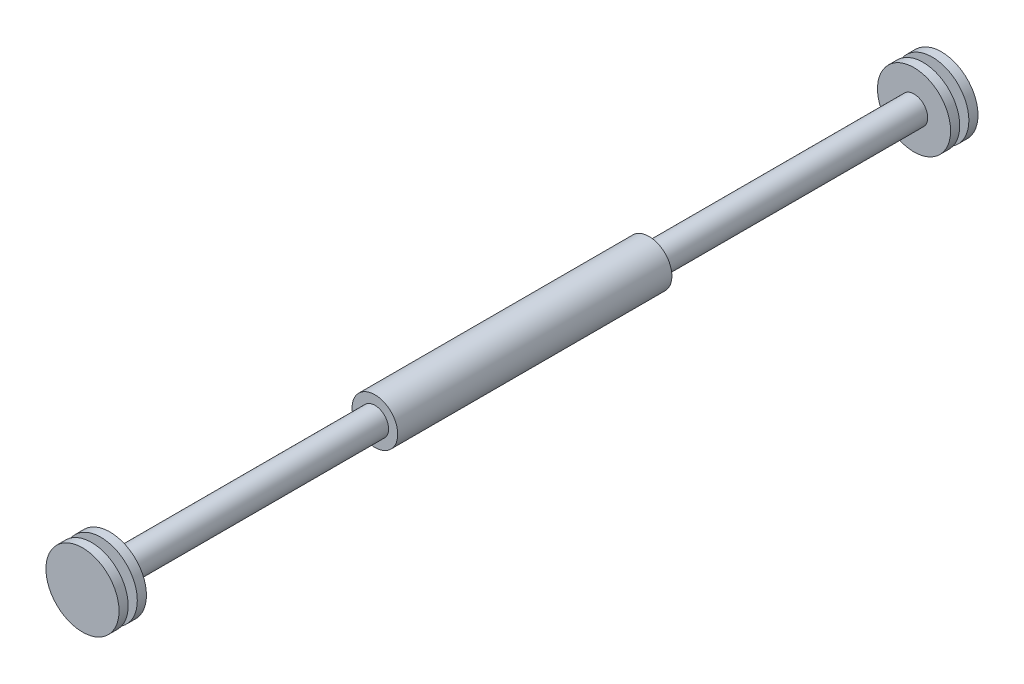
from build123d import *

# Parameters (mm, degrees)
SKETCH_1_R       = 3
EXTRUDE_1_DEPTH  = 180
SKETCH_2_R       = 8
EXTRUDE_2_DEPTH  = 2
EXTRUDE_START    = -178
SKETCH_2_2_R     = 8
EXTRUDE_3_DEPTH  = 2
EXTRUDE_START_2  = -2
SKETCH_1_2_R     = 3
EXTRUDE_4_DEPTH  = 2
EXTRUDE_START_3  = 180
SKETCH_1_3_R     = 3
EXTRUDE_5_DEPTH  = 2
EXTRUDE_START_4  = 4
SKETCH_2_3_R     = 8
EXTRUDE_6_DEPTH  = 2
EXTRUDE_START_5  = -182
SKETCH_2_4_R     = 8
EXTRUDE_7_DEPTH  = 2
EXTRUDE_START_6  = -64
SKETCH_3_R       = 5
EXTRUDE_10_DEPTH = 60


with BuildPart() as part:
    # 草图1 → 凸台-拉伸1 (new body)
    with BuildSketch(Plane.XY):
        with Locations(Location((0, 0, 0), (0, 0, 180))):
            Circle(SKETCH_1_R)
    extrude(amount=EXTRUDE_1_DEPTH)

    # 草图2 → 凸台-拉伸2 (add)
    with BuildSketch(Plane.XY.offset(180)):
        Circle(SKETCH_2_R)
    extrude(amount=-EXTRUDE_2_DEPTH)

    # 草图2<2> → 凸台-拉伸3 (add)
    with BuildSketch(Plane.XY.offset(180).offset(EXTRUDE_START)):
        Circle(SKETCH_2_2_R)
    extrude(amount=-EXTRUDE_3_DEPTH)

    # 草图1<2> → 凸台-拉伸4 (add)
    with BuildSketch(Plane.XY.offset(EXTRUDE_START_2)):
        with Locations(Location((0, 0, 0), (0, 0, 180))):
            Circle(SKETCH_1_2_R)
    extrude(amount=EXTRUDE_4_DEPTH)

    # 草图1<3> → 凸台-拉伸5 (add)
    with BuildSketch(Plane.XY.offset(EXTRUDE_START_3)):
        with Locations(Location((0, 0, 0), (0, 0, 180))):
            Circle(SKETCH_1_3_R)
    extrude(amount=EXTRUDE_5_DEPTH)

    # 草图2<3> → 凸台-拉伸6 (add)
    with BuildSketch(Plane.XY.offset(180).offset(EXTRUDE_START_4)):
        Circle(SKETCH_2_3_R)
    extrude(amount=-EXTRUDE_6_DEPTH)

    # 草图2<4> → 凸台-拉伸7 (add)
    with BuildSketch(Plane.XY.offset(180).offset(EXTRUDE_START_5)):
        Circle(SKETCH_2_4_R)
    extrude(amount=-EXTRUDE_7_DEPTH)

    # 草图3 → 凸台-拉伸10 (add)
    with BuildSketch(Plane.XY.offset(184).offset(EXTRUDE_START_6)):
        Circle(SKETCH_3_R)
    extrude(amount=-EXTRUDE_10_DEPTH)


solid = part.part
